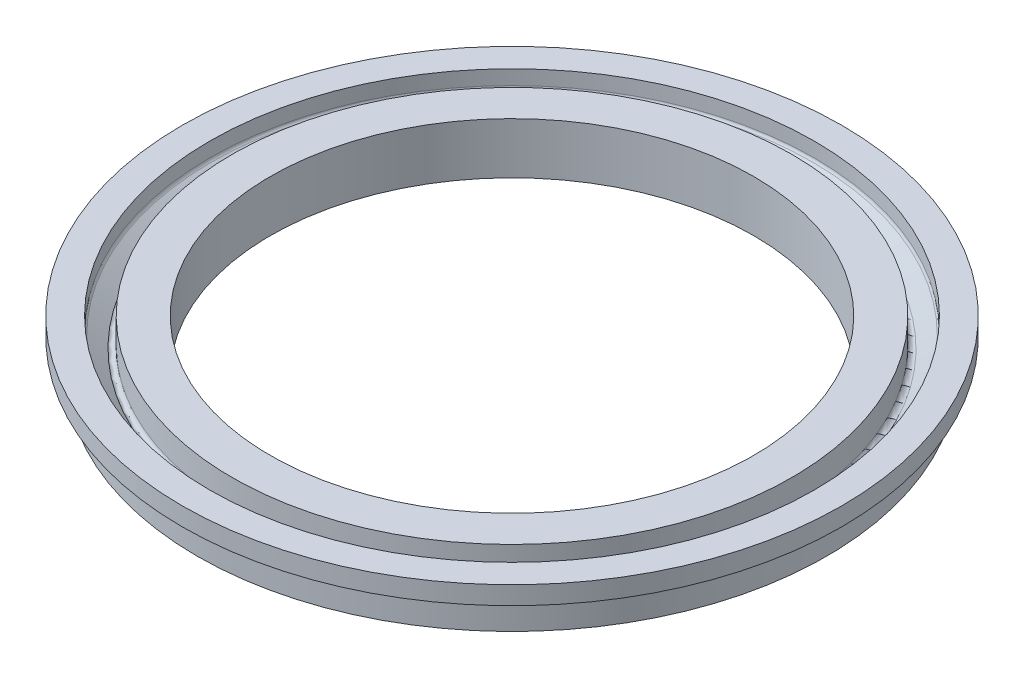
from build123d import *

# Parameters (mm, degrees)
REDONDEO1_R = 0.25


with BuildPart() as part:
    # Sketch1 → Revolución1 (revolve)
    with BuildSketch(Plane.XY, mode=Mode.PRIVATE) as revoluci_n1_sk:
        Polygon((-16.5, 0.045477085), (-16.5, 3.545477085), (-19.109062089, 3.545477085), (-19.109062089, 1.335016365), (-20.636358847, 2.444124724), (-20.636358847, 3.568650883), (-22.509115585, 3.568650883), (-22.509115585, 2.32755411), (-21.490917747, 1.893956842), (-21.490917747, 0.082983284), align=None)
    revolve(revoluci_n1_sk.sketch.rotate(Axis((0, -2.529637584, 0), (0, 1, 0)), 270), axis=Axis((0, -2.529637584, 0), (0, 1, 0)))

    # Redondeo1
    redondeo1_edges = [part.edges().sort_by_distance(p)[0] for p in [
        (0, 1.335016365, 19.109062089),
        (0, 2.444124724, 20.636358847),
        (0, 1.893956842, 21.490917747),
    ]]
    fillet(redondeo1_edges, radius=REDONDEO1_R)


solid = part.part
